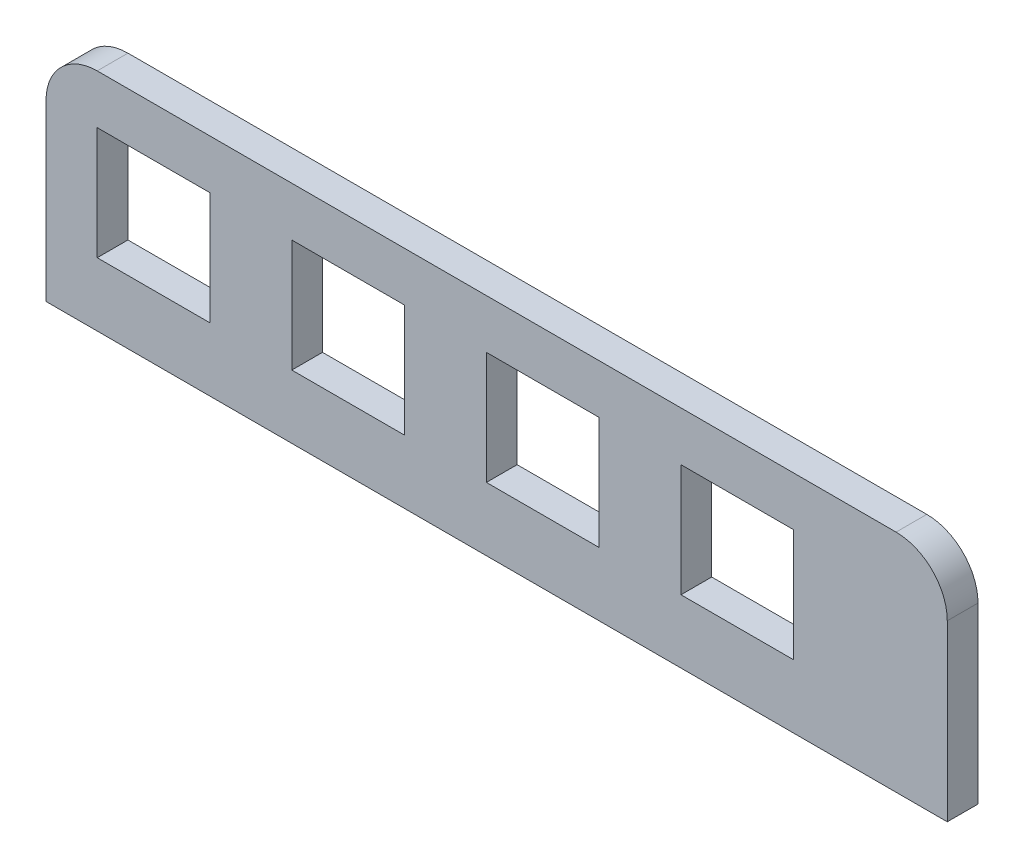
from build123d import *

# Parameters (mm, degrees)
SKETCH1_W           = 11
SKETCH1_H           = 11
BOSS_EXTRUDE1_DEPTH = 3


with BuildPart() as part:
    # Sketch1 → Boss-Extrude1 (new body)
    with BuildSketch(Plane.XY):
        with BuildLine():
            Line((0, 0), (88, 0))
            Line((88, 0), (88, 17))
            ThreePointArc((88, 17), (86.535533906, 20.535533906), (83, 22))
            Line((83, 22), (5, 22))
            ThreePointArc((5, 22), (1.464466094, 20.535533906), (0, 17))
            Line((0, 17), (0, 0))
        make_face()
        with Locations((10.5, 11.7)):
            Rectangle(SKETCH1_W, SKETCH1_H, mode=Mode.SUBTRACT)
        with Locations((29.5, 11.7)):
            Rectangle(SKETCH1_W, SKETCH1_H, mode=Mode.SUBTRACT)
        with Locations((48.5, 11.7)):
            Rectangle(SKETCH1_W, SKETCH1_H, mode=Mode.SUBTRACT)
        with Locations((67.5, 11.7)):
            Rectangle(SKETCH1_W, SKETCH1_H, mode=Mode.SUBTRACT)
    extrude(amount=BOSS_EXTRUDE1_DEPTH)


solid = part.part
